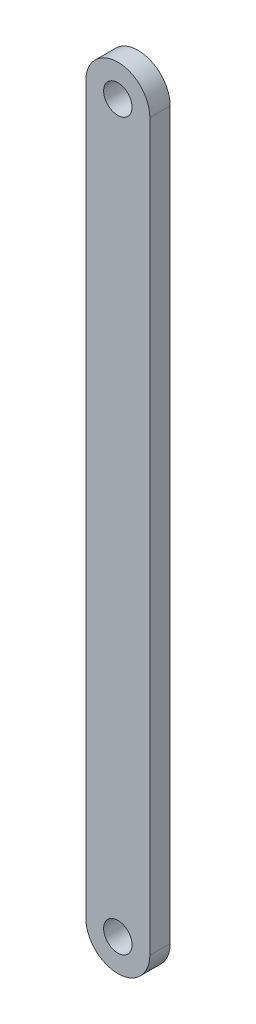
from build123d import *

# Parameters (mm, degrees)
ESBO_O1_R                = 3.325
RESSALTO_EXTRUS_O1_DEPTH = 4.7625


with BuildPart() as part:
    # Esboço1 → Ressalto-extrusão1 (new body)
    with BuildSketch(Plane.XY):
        with BuildLine():
            Line((-7.5, 0), (-7.5, 170))
            ThreePointArc((-7.5, 170), (0, 177.5), (7.5, 170))
            Line((7.5, 170), (7.5, 0))
            ThreePointArc((7.5, 0), (0, -7.5), (-7.5, 0))
        make_face()
        with Locations(Location((0, 170, 0), (0, 0, 180))):
            Circle(ESBO_O1_R, mode=Mode.SUBTRACT)
        with Locations(Location((0, 0, 0), (0, 0, 180))):
            Circle(ESBO_O1_R, mode=Mode.SUBTRACT)
    extrude(amount=RESSALTO_EXTRUS_O1_DEPTH)


solid = part.part
